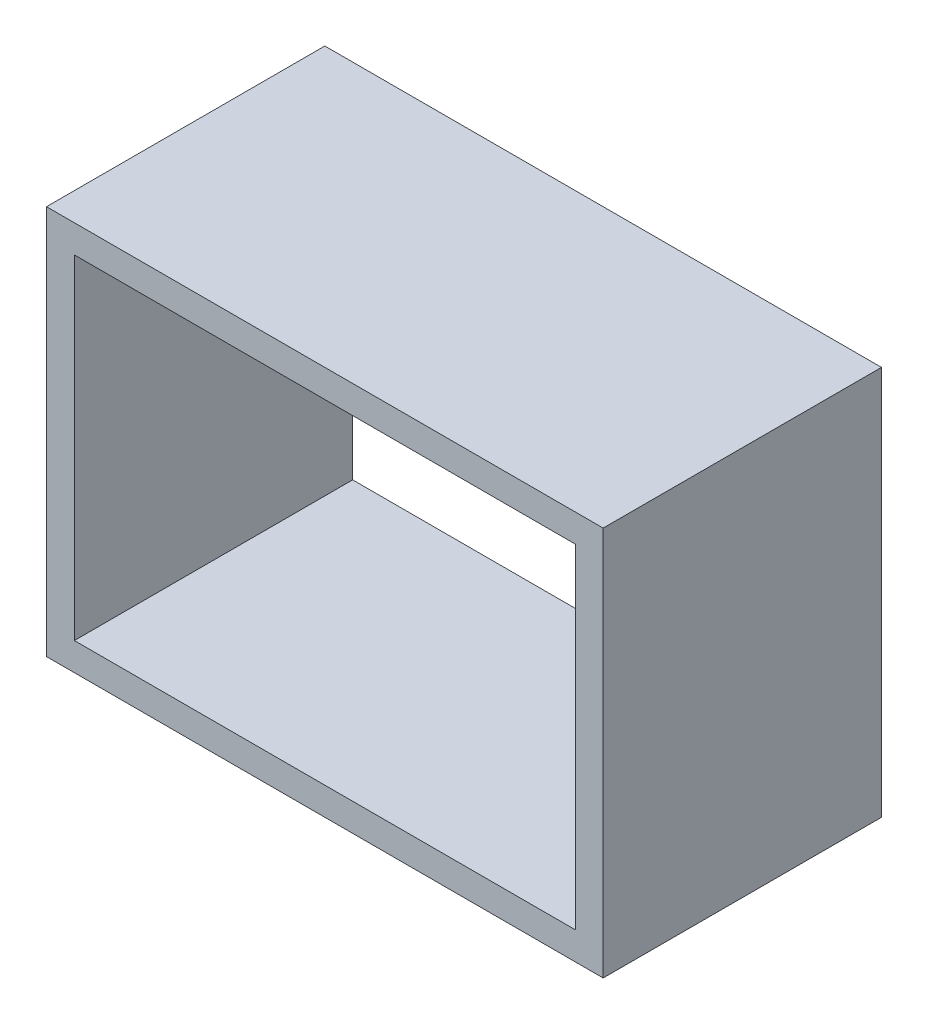
from build123d import *

# Parameters (mm, degrees)
SKETCH1_W           = 200
SKETCH1_H           = 140
SKETCH1_W_2         = 180
SKETCH1_H_2         = 120
EXTRUDE_THIN1_DEPTH = 100


with BuildPart() as part:
    # Sketch1 → Extrude-Thin1 (new body)
    with BuildSketch(Plane.XY):
        Rectangle(SKETCH1_W, SKETCH1_H)
        Rectangle(SKETCH1_W_2, SKETCH1_H_2, mode=Mode.SUBTRACT)
    extrude(amount=EXTRUDE_THIN1_DEPTH)


solid = part.part
